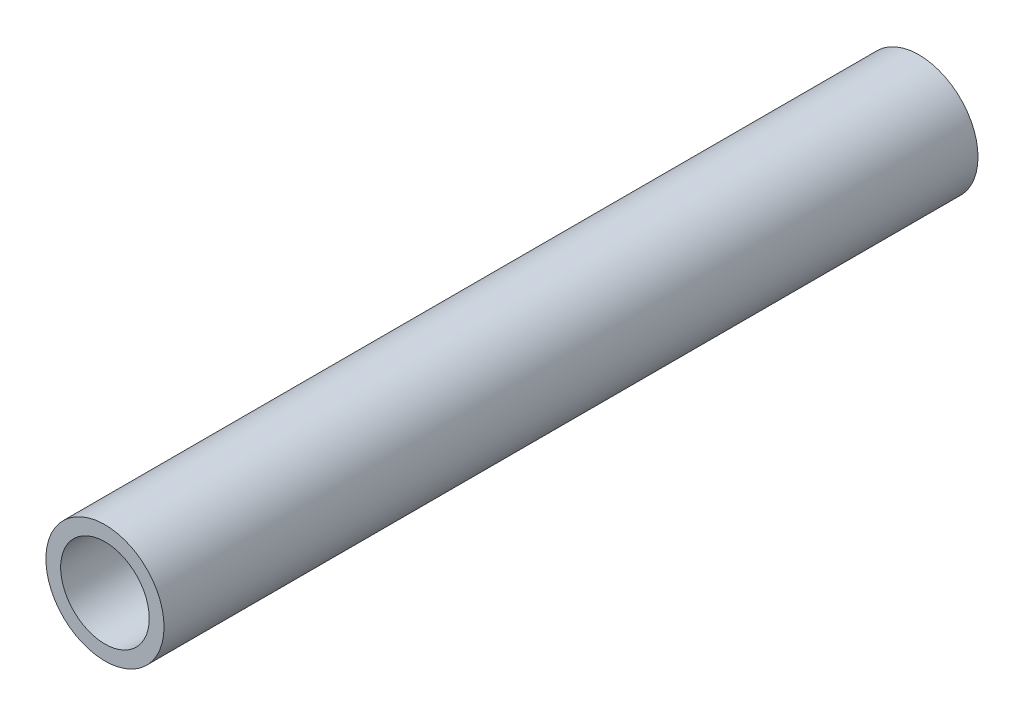
from build123d import *

# Parameters (mm, degrees)
SKETCH1_R           = 0.508
SKETCH1_R_2         = 0.381
BOSS_EXTRUDE1_DEPTH = 7


with BuildPart() as part:
    # Sketch1 → Boss-Extrude1 (new body)
    with BuildSketch(Plane.XY):
        Circle(SKETCH1_R)
        Circle(SKETCH1_R_2, mode=Mode.SUBTRACT)
    extrude(amount=BOSS_EXTRUDE1_DEPTH)


solid = part.part
